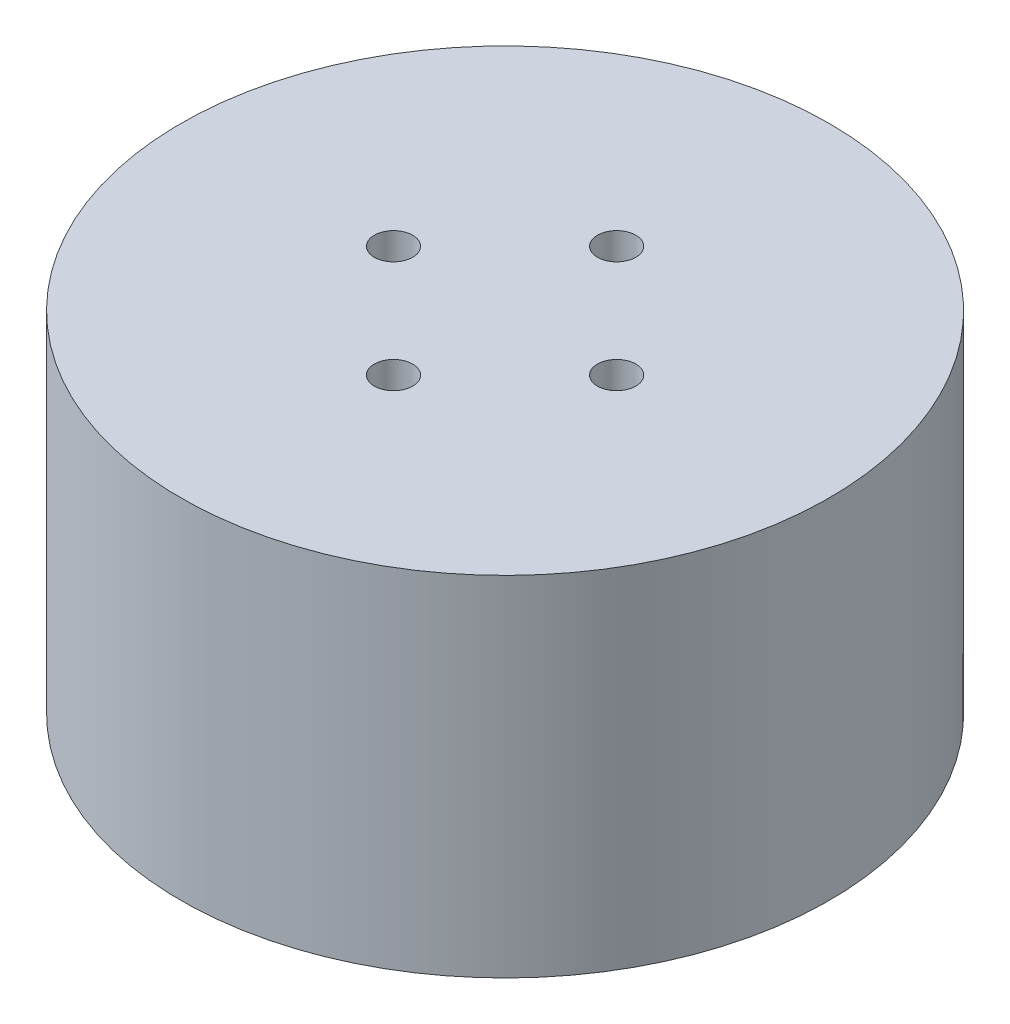
from build123d import *

# Parameters (mm, degrees)
ESQUISSE1_R              = 47.75
BOSS_EXTRU_1_DEPTH       = 50
ESQUISSE2_R              = 26
ENL_V_MAT_EXTRU_1_DEPTH  = 20
ESQUISSE3_R              = 11
ENL_V_MAT_EXTRU_5_DEPTH  = 7.5
ESQUISSE4_R              = 5
ENL_V_MAT_EXTRU_6_DEPTH  = 13.5
ESQUISSE11_R             = 2.75
ENL_V_MAT_EXTRU_11_DEPTH = 85.024549984
ESQUISSE12_R             = 47.75
ESQUISSE12_R_2           = 46.5
ENL_V_MAT_EXTRU_12_DEPTH = 85.024549984


with BuildPart() as part:
    # Esquisse1 → Boss.-Extru.1 (new body)
    with BuildSketch(Plane(origin=(0, 0, 0), x_dir=(1, 0, 0), z_dir=(0, 1, 0))):
        with Locations(Location((0, 0, 0), (0, 0, 270))):
            Circle(ESQUISSE1_R)
    extrude(amount=BOSS_EXTRU_1_DEPTH)

    # Esquisse2 → Enlèv. mat.-Extru.1 (cut)
    with BuildSketch(Plane(origin=(0, 0, 0), x_dir=(-1, 0, 0), z_dir=(0, -1, 0))):
        with Locations(Location((0, 0, 0), (0, 0, 90))):
            Circle(ESQUISSE2_R)
    extrude(amount=-ENL_V_MAT_EXTRU_1_DEPTH, mode=Mode.SUBTRACT)

    # Esquisse3 → Enlèv. mat.-Extru.5 (cut)
    with BuildSketch(Plane(origin=(0, 20, 0), x_dir=(-1, 0, 0), z_dir=(0, -1, 0))):
        with Locations(Location((0, 0, 0), (0, 0, 90))):
            Circle(ESQUISSE3_R)
    extrude(amount=-ENL_V_MAT_EXTRU_5_DEPTH, mode=Mode.SUBTRACT)

    # Esquisse4 → Enlèv. mat.-Extru.6 (cut)
    with BuildSketch(Plane(origin=(0, 27.5, 0), x_dir=(-1, 0, 0), z_dir=(0, -1, 0))):
        with Locations(Location((0, 0, 0), (0, 0, 90))):
            Circle(ESQUISSE4_R)
    extrude(amount=-ENL_V_MAT_EXTRU_6_DEPTH, mode=Mode.SUBTRACT)

    # Esquisse11 → Enlèv. mat.-Extru.11 (cut, through all)
    with BuildSketch(Plane(origin=(0, 50, 0), x_dir=(1, 0, 0), z_dir=(0, 1, 0))):
        with Locations(Location((-16, 0, 0), (0, 0, 270))):
            Circle(ESQUISSE11_R)
        with Locations(Location((0, 16, 0), (0, 0, 270))):
            Circle(ESQUISSE11_R)
        with Locations(Location((16, 0, 0), (0, 0, 270))):
            Circle(ESQUISSE11_R)
        with Locations(Location((0, -16, 0), (0, 0, 270))):
            Circle(ESQUISSE11_R)
    extrude(amount=-ENL_V_MAT_EXTRU_11_DEPTH, mode=Mode.SUBTRACT)

    # Esquisse12 → Enlèv. mat.-Extru.12 (cut, through all)
    with BuildSketch(Plane.XZ):
        Circle(ESQUISSE12_R)
        with Locations(Location((0, 0, 0), (0, 0, 270))):
            Circle(ESQUISSE12_R_2, mode=Mode.SUBTRACT)
    extrude(amount=-ENL_V_MAT_EXTRU_12_DEPTH, mode=Mode.SUBTRACT)


solid = part.part
